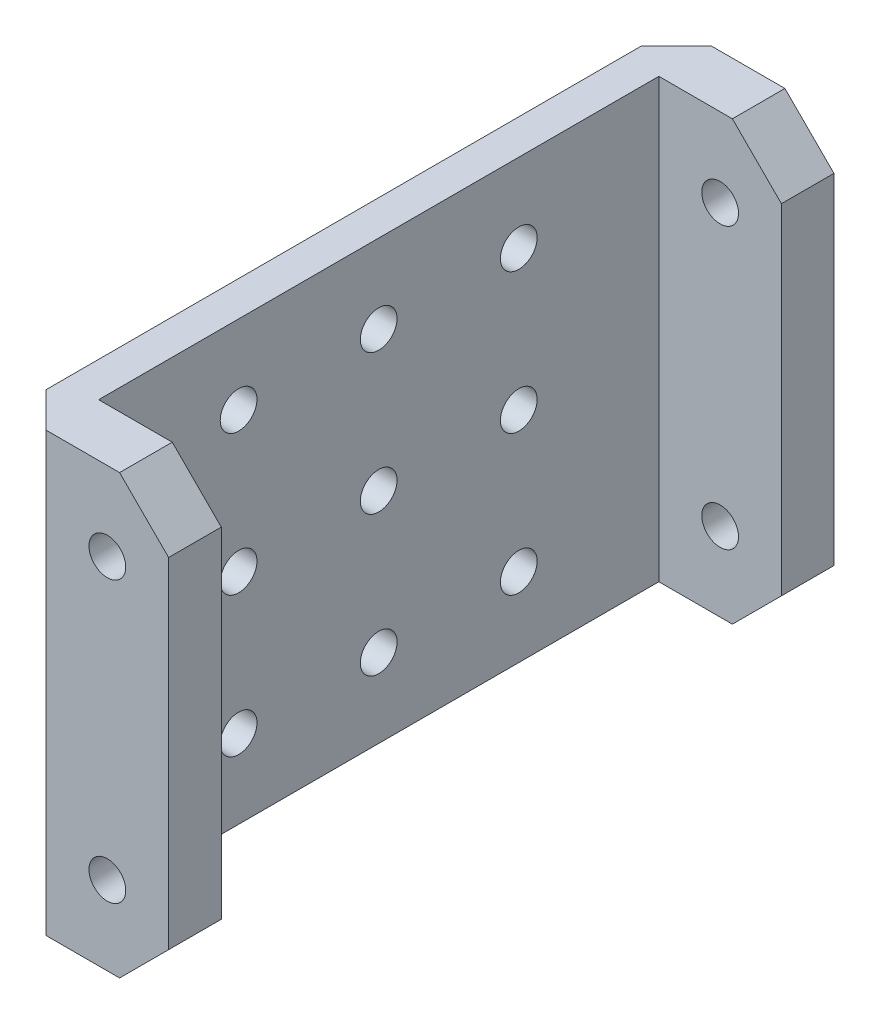
from build123d import *

# Parameters (mm, degrees)
SKETCH_1_W                  = 25
SKETCH_1_H                  = 38
EXTRUDE_1_DEPTH             = 9
CUT_EXTRUDE_1_DEPTH         = 47.368092477
HOLE_WIZARD_2_1_2_1_1_D     = 2.1
HOLE_WIZARD_2_1_2_1_1_DEPTH = 9
HOLE_WIZARD_2_1_2_1_2_D     = 2.1
HOLE_WIZARD_2_1_2_1_2_DEPTH = 9
HOLE_WIZARD_2_1_2_1_3_D     = 2.1
HOLE_WIZARD_2_1_2_1_3_DEPTH = 9
HOLE_WIZARD_2_1_2_1_4_D     = 2.1
HOLE_WIZARD_2_1_2_1_4_DEPTH = 3.007193387
CHAMFER_1_SIZE              = 2
SKETCH_12_R                 = 1.05
CUT_EXTRUDE_2_DEPTH         = 10
SKETCH_15_R                 = 1.05
CUT_EXTRUDE_3_DEPTH         = 10
CUT_EXTRUDE_4_DEPTH         = 47.368092478
CUT_EXTRUDE_5_DEPTH         = 47.368092477
CUT_EXTRUDE_5_DEPTH_BACK    = 47.368092477


with BuildPart() as part:
    # 草图1 → 凸台-拉伸1 (new body)
    with BuildSketch(Plane(origin=(0, 0, 0), x_dir=(0, -1, 0), z_dir=(-1, 0, 0))):
        with Locations((-12.5, 19)):
            Rectangle(SKETCH_1_W, SKETCH_1_H)
    extrude(amount=-EXTRUDE_1_DEPTH)

    # 草图2 → 切除-拉伸1 (cut, through all)
    with BuildSketch(Plane(origin=(0, 25, 0), x_dir=(-1, 0, 0), z_dir=(0, 1, 0))):
        Polygon((-9, 3), (-4, 3), (-3.996522166, 5.080336705), (-3.996522166, 33.000000217), (-3.996522166, 34.992806613), (-9, 34.992806613), align=None)
    extrude(amount=-CUT_EXTRUDE_1_DEPTH, mode=Mode.SUBTRACT)

    # Ø2.1 (2.1) 直径孔1
    with Locations(Plane.ZY):
        with Locations((11, 4.5)):
            Hole(HOLE_WIZARD_2_1_2_1_1_D / 2, depth=HOLE_WIZARD_2_1_2_1_1_DEPTH)

    # Ø2.1 (2.1) 直径孔2
    with Locations(Plane.ZY):
        with Locations((19, 4.5)):
            Hole(HOLE_WIZARD_2_1_2_1_2_D / 2, depth=HOLE_WIZARD_2_1_2_1_2_DEPTH)

    # Ø2.1 (2.1) 直径孔3
    with Locations(Plane.ZY):
        with Locations((27, 4.5), (27, 12.5), (27, 20.5), (11, 12.5), (11, 20.5), (19, 20.5), (19, 12.5)):
            Hole(HOLE_WIZARD_2_1_2_1_3_D / 2, depth=HOLE_WIZARD_2_1_2_1_3_DEPTH)

    # Ø2.1 (2.1) 直径孔4
    with Locations(Plane(origin=(0, 0, 34.992806613), x_dir=(-1, 0, 0), z_dir=(0, 0, -1))):
        with Locations((-5.5, 4.5), (-5.5, 20.5)):
            Hole(HOLE_WIZARD_2_1_2_1_4_D / 2, depth=HOLE_WIZARD_2_1_2_1_4_DEPTH)

    # 倒角1
    chamfer_1_edges = [part.edges().sort_by_distance(p)[0] for p in [
        (0, 12.5, 0),
        (0, 12.5, 38),
    ]]
    chamfer(chamfer_1_edges, length=CHAMFER_1_SIZE)

    # 草图12 → 切除-拉伸2 (cut)
    with BuildSketch(Plane.XY.offset(3)):
        with Locations(Location((5.5, 4.5, 0), (0, 0, 180))):
            Circle(SKETCH_12_R)
    extrude(amount=-CUT_EXTRUDE_2_DEPTH, mode=Mode.SUBTRACT)

    # 草图15 → 切除-拉伸3 (cut)
    with BuildSketch(Plane.XY.offset(3)):
        with Locations(Location((5.5, 20.5, 0), (0, 0, 180))):
            Circle(SKETCH_15_R)
    extrude(amount=-CUT_EXTRUDE_3_DEPTH, mode=Mode.SUBTRACT)

    # 草图16 → 切除-拉伸4 (cut, through all)
    with BuildSketch(Plane.XZ):
        Polygon((3.996522166, 34.992806613), (1.996522166, 34.992806613), (2, 3), (4, 3), align=None)
    extrude(amount=-CUT_EXTRUDE_4_DEPTH, mode=Mode.SUBTRACT)

    # 草图17 → 切除-拉伸5 (cut, two sides: drawn at the far end of the back side and taken through both)
    with BuildSketch(Plane.XY.offset(38).offset(-CUT_EXTRUDE_5_DEPTH_BACK)):
        Polygon((9, 22.2), (6.2, 25), (9, 25), align=None)
        Polygon((9, 0), (9, 2.8), (6.2, 0), align=None)
    extrude(amount=CUT_EXTRUDE_5_DEPTH + CUT_EXTRUDE_5_DEPTH_BACK, mode=Mode.SUBTRACT)


solid = part.part
